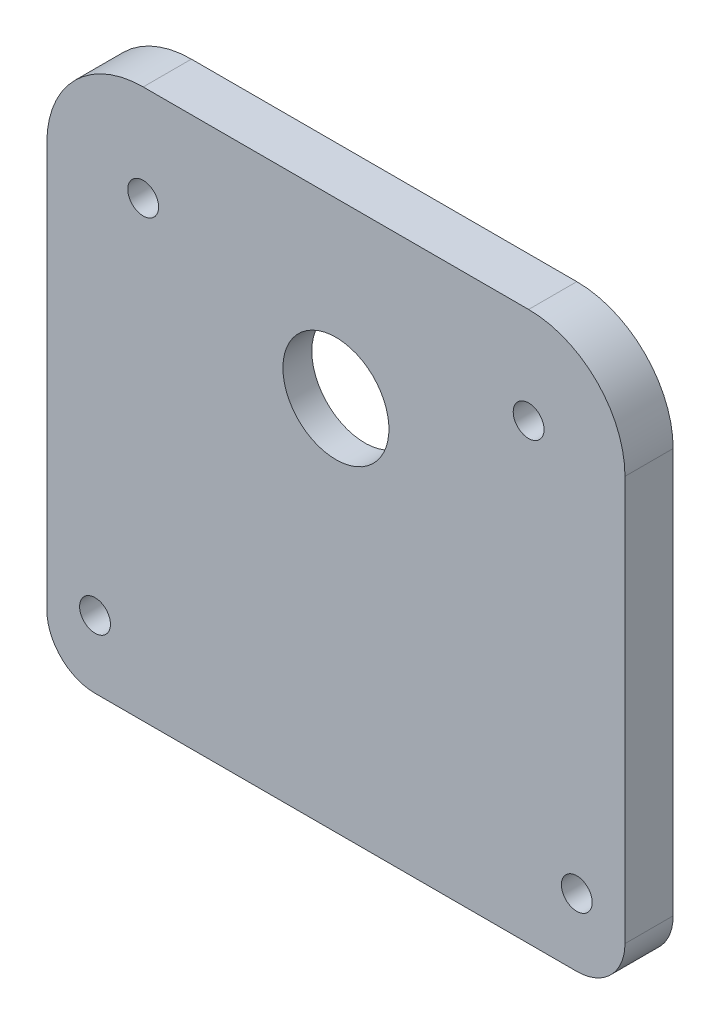
from build123d import *

# Parameters (mm, degrees)
SKETCH_1_W          = 60
SKETCH_1_H          = 50
SKETCH_1_R          = 15
EXTRUDE_5_DEPTH     = 5
SKETCH_4_W          = 60
SKETCH_4_H          = 50
SKETCH_4_R          = 5.5
EXTRUDE_6_DEPTH     = 5
SKETCH_5_R          = 1.6
CUT_EXTRUDE_1_DEPTH = 10
SKETCH_6_W          = 60
SKETCH_6_H          = 10
EXTRUDE_7_DEPTH     = 7
FILLET_3_R          = 10
FILLET_5_R          = 10
FILLET_6_R          = 5
FILLET_7_R          = 5
SKETCH_7_W          = 62.929868023
SKETCH_7_H          = 59.60365164
CUT_EXTRUDE_2_DEPTH = 5
SKETCH_8_R          = 15
CUT_EXTRUDE_3_DEPTH = 2
SKETCH_9_R          = 15
CUT_EXTRUDE_4_DEPTH = 2
SKETCH_10_R         = 5.5
CUT_EXTRUDE_6_DEPTH = 44.965895874
SKETCH_11_R         = 5.5
EXTRUDE_8_DEPTH     = 3
EXTRUDE_START       = 2
EXTRUDE_9_DEPTH     = 2


with BuildPart() as part:
    # 草图1 → 凸台-拉伸5 (new body)
    with BuildSketch(Plane.XY):
        Rectangle(SKETCH_1_W, SKETCH_1_H)
        Circle(SKETCH_1_R, mode=Mode.SUBTRACT)
    extrude(amount=EXTRUDE_5_DEPTH)

    # 草图4 → 凸台-拉伸6 (add)
    with BuildSketch(Plane.XY.offset(5)):
        Rectangle(SKETCH_4_W, SKETCH_4_H)
        Circle(SKETCH_4_R, mode=Mode.SUBTRACT)
    extrude(amount=EXTRUDE_6_DEPTH)

    # 草图5 → 切除-拉伸1 (cut)
    with BuildSketch(Plane(origin=(0, 0, 0), x_dir=(-1, 0, 0), z_dir=(0, 0, -1))):
        with Locations((-20, 22)):
            Circle(SKETCH_5_R)
        with Locations((-25, -18)):
            Circle(SKETCH_5_R)
        with Locations((20, 22)):
            Circle(SKETCH_5_R)
        with Locations((25, -18)):
            Circle(SKETCH_5_R)
    extrude(amount=-CUT_EXTRUDE_1_DEPTH, mode=Mode.SUBTRACT)

    # 草图6 → 凸台-拉伸7 (add)
    with BuildSketch(Plane(origin=(0, 25, 0), x_dir=(1, 0, 0), z_dir=(0, 1, 0))):
        with Locations((0, -5)):
            Rectangle(SKETCH_6_W, SKETCH_6_H)
    extrude(amount=EXTRUDE_7_DEPTH)

    # 圆角3
    fillet_3_edges = [part.edges().sort_by_distance(p)[0] for p in [
        (-30, 32, 5),
    ]]
    fillet(fillet_3_edges, radius=FILLET_3_R)

    # 圆角5
    fillet_5_edges = [part.edges().sort_by_distance(p)[0] for p in [
        (30, 32, 5),
    ]]
    fillet(fillet_5_edges, radius=FILLET_5_R)

    # 圆角6
    fillet_6_edges = [part.edges().sort_by_distance(p)[0] for p in [
        (-30, -25, 5),
    ]]
    fillet(fillet_6_edges, radius=FILLET_6_R)

    # 圆角7
    fillet_7_edges = [part.edges().sort_by_distance(p)[0] for p in [
        (30, -25, 5),
    ]]
    fillet(fillet_7_edges, radius=FILLET_7_R)

    # 草图7 → 切除-拉伸2 (cut)
    with BuildSketch(Plane(origin=(0, 0, 0), x_dir=(-1, 0, 0), z_dir=(0, 0, -1))):
        with Locations((0.697432467, 2.50749995)):
            Rectangle(SKETCH_7_W, SKETCH_7_H)
    extrude(amount=-CUT_EXTRUDE_2_DEPTH, mode=Mode.SUBTRACT)

    # 草图8 → 切除-拉伸3 (cut)
    with BuildSketch(Plane(origin=(0, 0, 5), x_dir=(-1, 0, 0), z_dir=(0, 0, -1))):
        Circle(SKETCH_8_R)
    extrude(amount=-CUT_EXTRUDE_3_DEPTH, mode=Mode.SUBTRACT)

    # 草图9 → 切除-拉伸4 (cut)
    with BuildSketch(Plane(origin=(0, 0, 5), x_dir=(-1, 0, 0), z_dir=(0, 0, -1))):
        with Locations((0, 14)):
            Circle(SKETCH_9_R)
        Circle(SKETCH_9_R)
        with BuildLine():
            ThreePointArc((-13.266499161, 7), (-14.560176637, 10.394274513), (-15, 14))
            Line((-15, 14), (-15, 0))
            ThreePointArc((-15, 0), (-14.560176637, 3.605725487), (-13.266499161, 7))
        make_face()
        with BuildLine():
            Line((15, 0), (15, 14))
            ThreePointArc((15, 14), (14.560176637, 10.394274513), (13.266499161, 7))
            ThreePointArc((13.266499161, 7), (14.560176637, 3.605725487), (15, 0))
        make_face()
    extrude(amount=-CUT_EXTRUDE_4_DEPTH, mode=Mode.SUBTRACT)

    # 草图10 → 切除-拉伸6 (cut, through all)
    with BuildSketch(Plane(origin=(0, 0, 7), x_dir=(-1, 0, 0), z_dir=(0, 0, -1))):
        with Locations((0, 14)):
            Circle(SKETCH_10_R)
    extrude(amount=-CUT_EXTRUDE_6_DEPTH, mode=Mode.SUBTRACT)

    # 草图11 → 凸台-拉伸8 (add)
    with BuildSketch(Plane(origin=(0, 0, 7), x_dir=(-1, 0, 0), z_dir=(0, 0, -1))):
        Circle(SKETCH_11_R)
    extrude(amount=-EXTRUDE_8_DEPTH)

    # 草图12 → 凸台-拉伸9 (add)
    with BuildSketch(Plane(origin=(0, 0, 7), x_dir=(-1, 0, 0), z_dir=(0, 0, -1)).offset(EXTRUDE_START)):
        with BuildLine():
            ThreePointArc((-13.266499161, 7), (-14.560176637, 3.605725487), (-15, 0))
            ThreePointArc((-15, 0), (0, -15), (15, 0))
            ThreePointArc((15, 0), (14.560176637, 3.605725487), (13.266499161, 7))
            ThreePointArc((13.266499161, 7), (0, -1), (-13.266499161, 7))
        make_face()
        with BuildLine():
            ThreePointArc((-13.266499161, 7), (-14.560176637, 10.394274513), (-15, 14))
            Line((-15, 14), (-15, 0))
            ThreePointArc((-15, 0), (-14.560176637, 3.605725487), (-13.266499161, 7))
        make_face()
        with BuildLine():
            Line((15, 0), (15, 14))
            ThreePointArc((15, 14), (14.560176637, 10.394274513), (13.266499161, 7))
            ThreePointArc((13.266499161, 7), (14.560176637, 3.605725487), (15, 0))
        make_face()
    extrude(amount=-EXTRUDE_9_DEPTH)


solid = part.part
